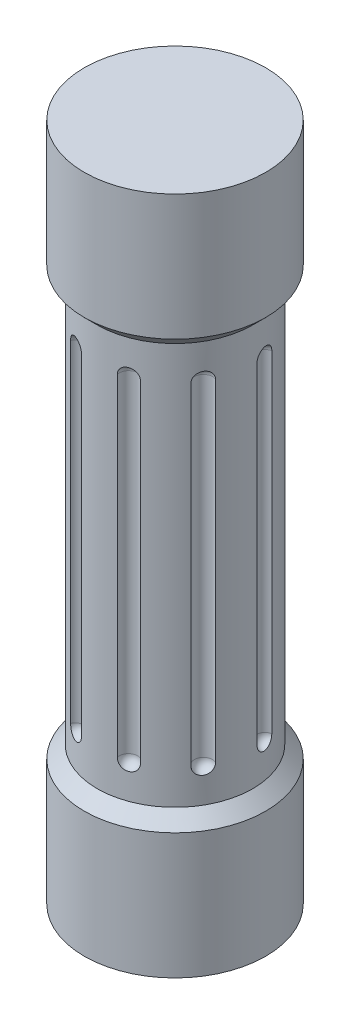
from build123d import *

# Parameters (mm, degrees)
COLUMN_CIRCULAR_PATTERN_CUT_COUNT = 9


with BuildPart() as part:
    # Sketch1 → Main Support Pole (revolve)
    with BuildSketch(Plane.XY, mode=Mode.PRIVATE) as main_support_pole_sk:
        Polygon((0, 0), (0, 26.2), (3.5, 26.2), (3.5, 23.35), (3.5, 21.35), (3, 20.85), (3, 5.35), (3.5, 4.85), (3.5, 2.85), (3.5, 0), align=None)
    revolve(main_support_pole_sk.sketch.rotate(Axis((0, 26.2, 0), (0, 1, 0)), 90), axis=Axis((0, 26.2, 0), (0, 1, 0)))

    # Sketch2 → Column Cut (revolve, cut)
    with BuildSketch(Plane(origin=(0, 0, 0), x_dir=(0, 0, -1), z_dir=(1, 0, 0))):
        with BuildLine():
            Line((3, 19.85), (3, 6.35))
            ThreePointArc((3, 6.35), (2.752512627, 6.452512627), (2.65, 6.7))
            Line((2.65, 6.7), (2.65, 19.5))
            ThreePointArc((2.65, 19.5), (2.752512627, 19.747487373), (3, 19.85))
        make_face()
    column_cut = revolve(axis=Axis((0, 19.85, -3), (0, 1, 0)), mode=Mode.SUBTRACT)

    # Column Circular Pattern Cut: Column Cut ×9 about axis
    column_circular_pattern_cut_axis = Axis((0, 0, 0), (0, 1, 0))
    for i in range(1, COLUMN_CIRCULAR_PATTERN_CUT_COUNT):
        add(column_cut.rotate(column_circular_pattern_cut_axis, i * 360 / COLUMN_CIRCULAR_PATTERN_CUT_COUNT), mode=Mode.SUBTRACT)


solid = part.part
